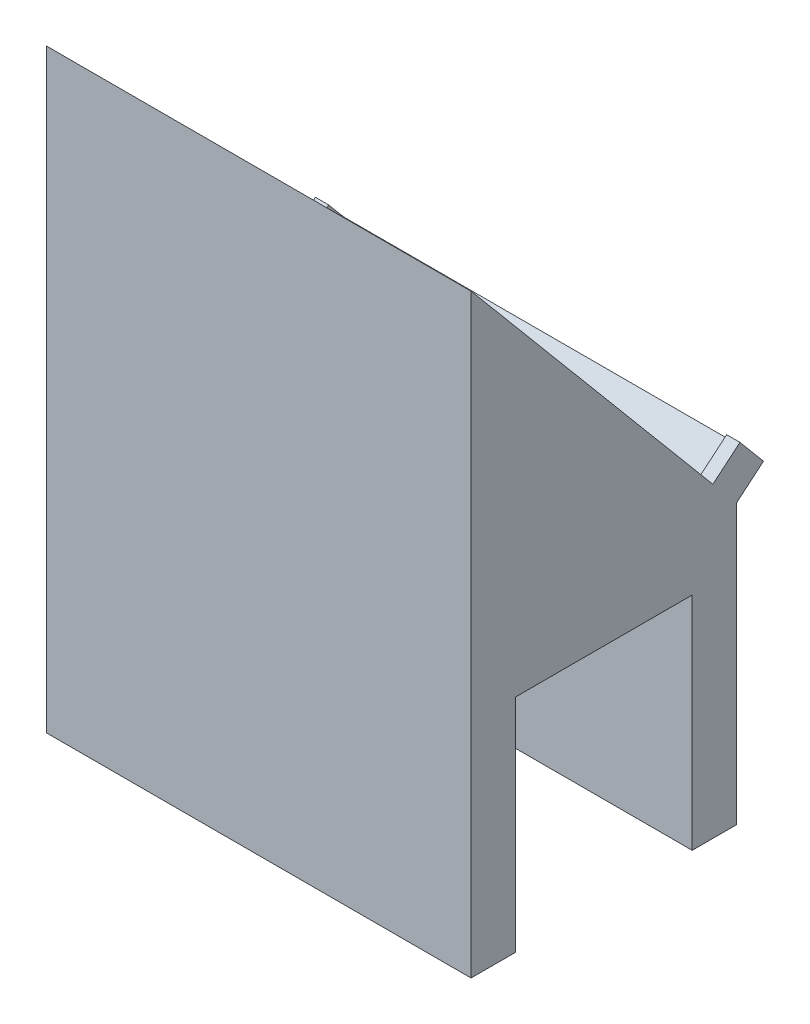
from build123d import *

# Parameters (mm, degrees)
EXTRUDE_1_DEPTH = 96
EXTRUDE_2_DEPTH = 8


with BuildPart() as part:
    # Эскиз1 → Бобышка-Вытянуть1 (new body)
    with BuildSketch(Plane(origin=(0, 0, 0), x_dir=(0, 0, -1), z_dir=(1, 0, 0))):
        Polygon((0, 109.262066559), (60, 37.756851003), (60, -25.242859431), (50, -25.242859431), (50, 24.757140569), (10, 24.757140569), (10, -25.242859431), (0, -25.242859431), align=None)
    extrude(amount=EXTRUDE_1_DEPTH)

    # Эскиз3 → Бобышка-Вытянуть2 (add)
    with BuildSketch(Plane(origin=(0, 45.144453906, -53.801065128), x_dir=(-1, 0, 0), z_dir=(0, 0.6427876096865404, -0.7660444431189771))):
        Polygon((-96, -1.355361582), (-96, -9.643830681), (0, -9.643830681), (0, -1.355361582), (-3, -1.355361582), (-3, -6.643830681), (-93, -6.643830681), (-93, -1.355361582), align=None)
    extrude(amount=EXTRUDE_2_DEPTH)


solid = part.part
